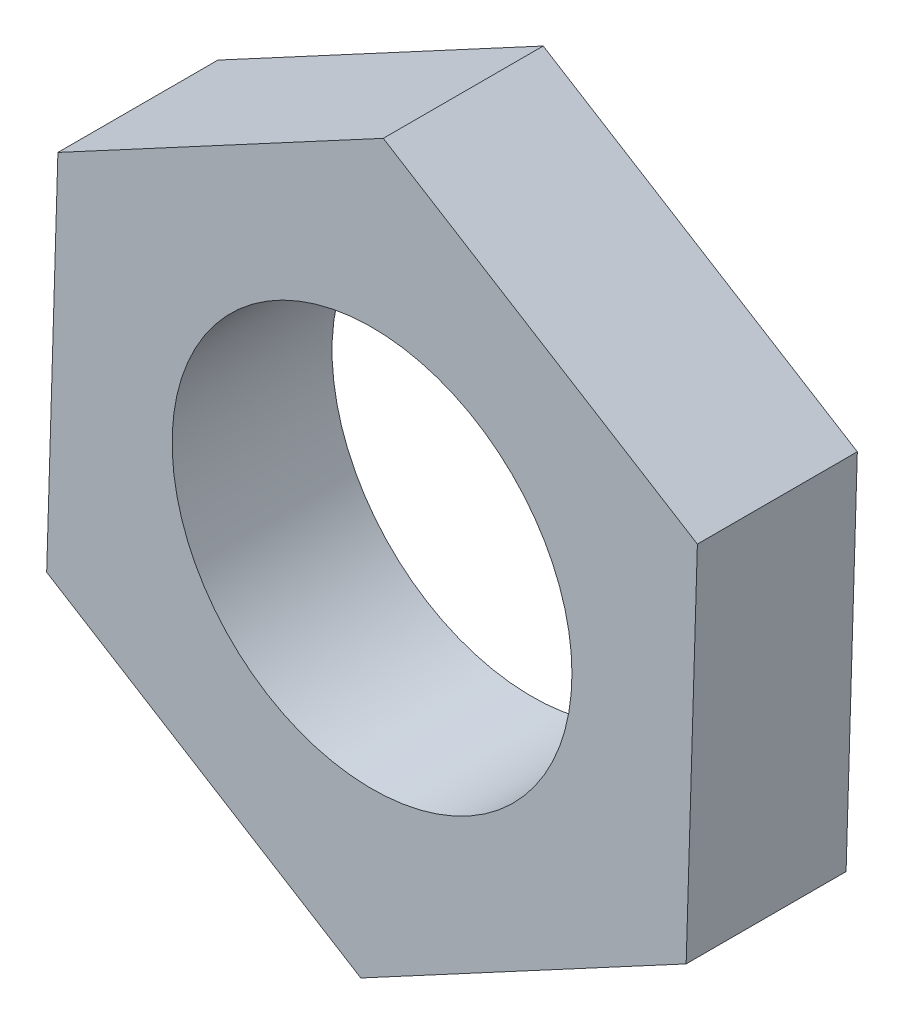
from build123d import *

# Parameters (mm, degrees)
SKETCH1_R           = 25
BOSS_EXTRUDE1_DEPTH = 20


with BuildPart() as part:
    # Sketch1 → Boss-Extrude1 (new body)
    with BuildSketch(Plane.XY):
        Polygon((40.683536218, 21.867400717), (1.404043573, 46.166676239), (-39.279492645, 24.299275522), (-40.683536218, -21.867400717), (-1.404043573, -46.166676239), (39.279492645, -24.299275522), align=None)
        Circle(SKETCH1_R, mode=Mode.SUBTRACT)
    extrude(amount=BOSS_EXTRUDE1_DEPTH)


solid = part.part
